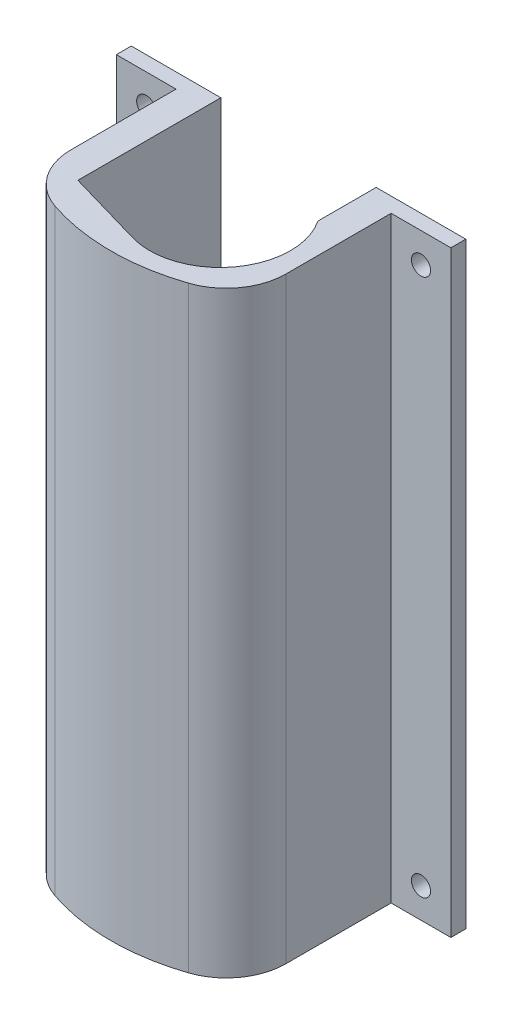
from build123d import *

# Parameters (mm, degrees)
BOSS_EXTRUDE1_DEPTH = 127
SKETCH2_R           = 2.032
CUT_EXTRUDE1_DEPTH  = 139.014433952
FILLET2_R           = 12.7


with BuildPart() as part:
    # Sketch1 → Boss-Extrude1 (new body)
    with BuildSketch(Plane(origin=(0, 0, 0), x_dir=(1, 0, 0), z_dir=(0, 1, 0))):
        with BuildLine():
            Line((-20.574, -9.652129604), (-4.162019583, -14.39674322))
            ThreePointArc((-4.162019583, -14.39674322), (12.103082443, -8.837647749), (12.446, 8.347796497))
            Line((12.446, 8.347796497), (12.446, 20.746712887))
            Line((12.446, 20.746712887), (31.496, 20.746712887))
            Line((31.496, 20.746712887), (31.496, 17.571712887))
            Line((31.496, 17.571712887), (18.796, 17.571712887))
            Line((18.796, 17.571712887), (18.796, -12.827129604))
            ThreePointArc((18.796, -12.827129604), (-4.064, -19.155968814), (-26.924, -12.827129604))
            Line((-26.924, -12.827129604), (-26.924, 17.571712887))
            Line((-26.924, 17.571712887), (-39.624, 17.571712887))
            Line((-39.624, 17.571712887), (-39.624, 20.746712887))
            Line((-39.624, 20.746712887), (-20.574, 20.746712887))
            Line((-20.574, 20.746712887), (-20.574, 9.652))
            Line((-20.574, 9.652), (-20.574, -9.652129604))
        make_face()
    extrude(amount=BOSS_EXTRUDE1_DEPTH)

    # Sketch2 → Cut-Extrude1 (cut, through all)
    with BuildSketch(Plane.XY.offset(-17.571712887)):
        with Locations((-33.274, 120.65)):
            Circle(SKETCH2_R)
        with Locations((-33.274, 6.35)):
            Circle(SKETCH2_R)
        with Locations((25.146, 120.65)):
            Circle(SKETCH2_R)
        with Locations((25.146, 6.35)):
            Circle(SKETCH2_R)
    extrude(amount=-CUT_EXTRUDE1_DEPTH, mode=Mode.SUBTRACT)

    # Fillet2
    fillet2_edges = [part.edges().sort_by_distance(p)[0] for p in [
        (18.796, 63.5, 12.827129604),
        (-26.924, 63.5, 12.827129604),
    ]]
    fillet(fillet2_edges, radius=FILLET2_R)


solid = part.part
